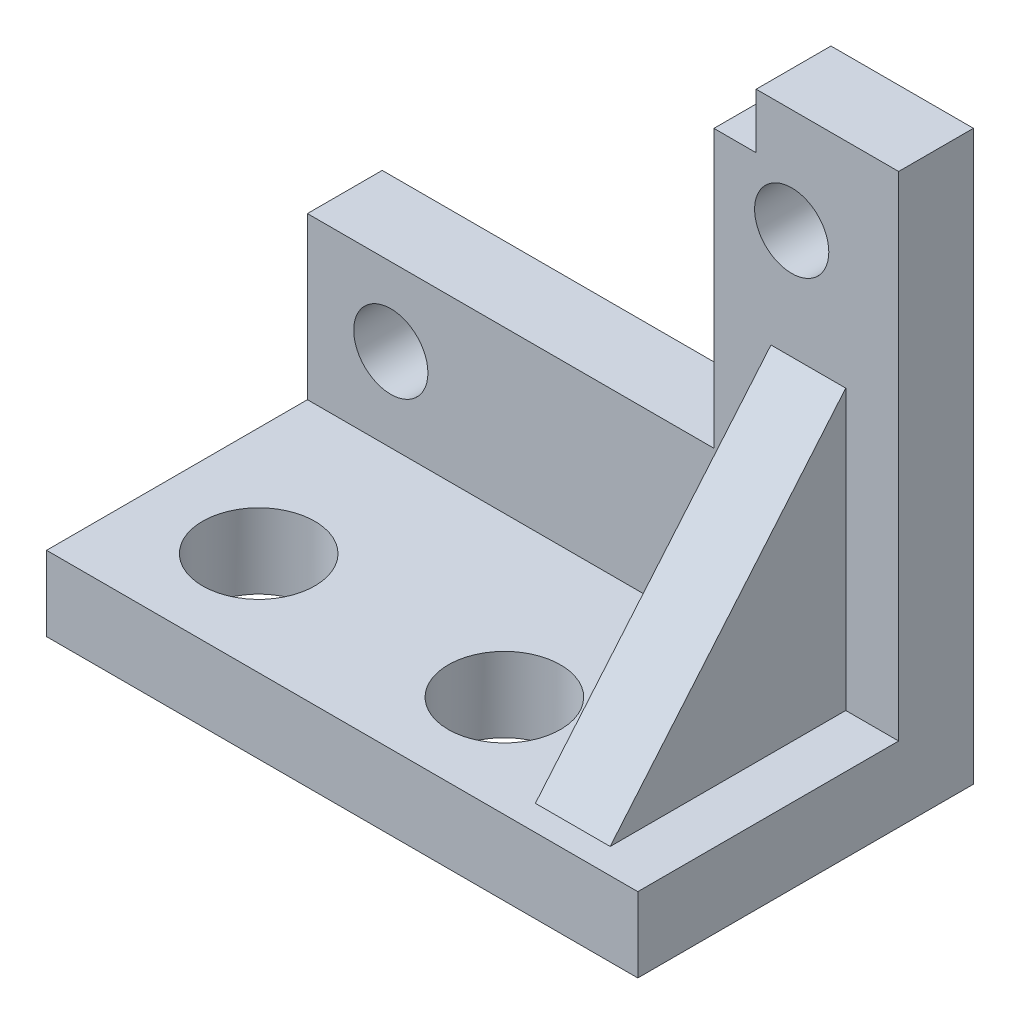
from build123d import *

# Parameters (mm, degrees)
SKETCH2_R           = 1.5748
BOSS_EXTRUDE1_DEPTH = 3.175
SKETCH5_W           = 24.098
SKETCH5_H           = 3.175
BOSS_EXTRUDE2_DEPTH = 19.05
SKETCH7_W           = 1
SKETCH7_H           = 6.842
BOSS_EXTRUDE3_DEPTH = 3.175
SKETCH8_W           = 1
SKETCH8_H           = 3.175
BOSS_EXTRUDE4_DEPTH = 19.05
SKETCH9_W           = 3.175
SKETCH9_H           = 11.85042952
BOSS_EXTRUDE5_DEPTH = 10
CUT_EXTRUDE1_DEPTH  = 33.332180825
SKETCH11_R          = 2.38125
CUT_EXTRUDE5_DEPTH  = 10


with BuildPart() as part:
    # Sketch2 → Boss-Extrude1 (new body)
    with BuildSketch(Plane.XY):
        Polygon((4.395213829, 10.321811953), (4.395213829, 7.827388121), (4.395213829, -1.438404904), (-11.860786171, -1.438404904), (-11.860786171, -8.280404904), (12.237213829, -8.280404904), (12.237213829, 12.658595096), (7.697213829, 12.658595096), (6.188170382, 12.658595096), (6.188170382, 10.321811953), align=None)
        with Locations((-9.320786171, -4.740404904)):
            Circle(SKETCH2_R, mode=Mode.SUBTRACT)
        with Locations((7.697213829, 8.213595096)):
            Circle(SKETCH2_R, mode=Mode.SUBTRACT)
    extrude(amount=BOSS_EXTRUDE1_DEPTH)

    # Sketch5 → Boss-Extrude2 (add)
    with BuildSketch(Plane(origin=(0, 0, 0), x_dir=(-1, 0, 0), z_dir=(0, 0, -1))):
        with Locations((-0.188213829, -9.867904904)):
            Rectangle(SKETCH5_W, SKETCH5_H)
    extrude(amount=-BOSS_EXTRUDE2_DEPTH)

    # Sketch7 → Boss-Extrude3 (add)
    with BuildSketch(Plane.XY.offset(3.175)):
        with Locations((-12.360786171, -4.859404904)):
            Rectangle(SKETCH7_W, SKETCH7_H)
    extrude(amount=-BOSS_EXTRUDE3_DEPTH)

    # Sketch8 → Boss-Extrude4 (add)
    with BuildSketch(Plane.XY.offset(19.05)):
        with Locations((-12.360786171, -9.867904904)):
            Rectangle(SKETCH8_W, SKETCH8_H)
    extrude(amount=-BOSS_EXTRUDE4_DEPTH)

    # Sketch9 → Boss-Extrude5 (add)
    with BuildSketch(Plane.XY.offset(3.175)):
        with Locations((8.404008836, -2.355190144)):
            Rectangle(SKETCH9_W, SKETCH9_H)
    extrude(amount=BOSS_EXTRUDE5_DEPTH)

    # Sketch10 → Cut-Extrude1 (cut, through all)
    with BuildSketch(Plane(origin=(9.991508836, 0, 0), x_dir=(0, 0, -1), z_dir=(1, 0, 0))):
        Polygon((-3.175, 3.570024616), (-13.175, -8.280404904), (-13.175, 3.570024616), align=None)
    extrude(amount=-CUT_EXTRUDE1_DEPTH, mode=Mode.SUBTRACT)

    # Sketch11 → Cut-Extrude5 (cut)
    with BuildSketch(Plane(origin=(0, -8.280404904, 0), x_dir=(1, 0, 0), z_dir=(0, 1, 0))):
        with Locations(Location((-8.236677859, -9.867280651, 0), (0, 0, 270))):
            Circle(SKETCH11_R)
        Polygon((12.237213829, -14.248530651), (-8.236677859, -14.248530651), (-12.860786171, -14.248530651), (-12.860786171, -19.05), (12.237213829, -19.05), align=None)
        with Locations(Location((2.255867033, -9.930453782, 0), (0, 0, 270))):
            Circle(SKETCH11_R)
    extrude(amount=-CUT_EXTRUDE5_DEPTH, mode=Mode.SUBTRACT)


solid = part.part
